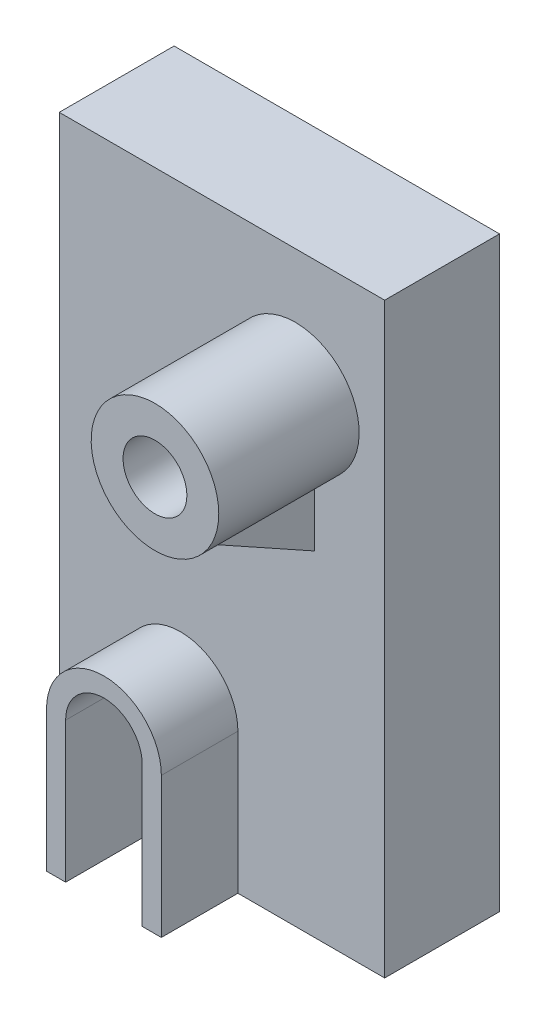
from build123d import *

# Parameters (mm, degrees)
EXTRUDE_2_DEPTH     = 18
EXTRUDE_3_DEPTH     = 30
SKETCH_1_8_R        = 5
EXTRUDE_4_DEPTH     = 40
EXTRUDE_5_DEPTH     = 36
CUT_EXTRUDE_1_DEPTH = 109


with BuildPart() as part:
    # Эскиз1 → Бобышка-Вытянуть2 (new body)
    with BuildSketch(Plane.XY):
        with BuildLine():
            Line((0, 92), (0, 0))
            Line((0, 0), (10, 0))
            Line((10, 0), (10, 22))
            ThreePointArc((10, 22), (19, 31), (28, 22))
            Line((28, 22), (28, 0))
            Line((28, 0), (51, 0))
            Line((51, 0), (51, 92))
            Line((51, 92), (0, 92))
        make_face()
        with BuildLine():
            Line((40, 52.460607986), (34, 52.460607986))
            Line((34, 52.460607986), (34, 62.460607986))
            ThreePointArc((34, 62.460607986), (31.083920217, 80.062257748), (47, 72))
            ThreePointArc((47, 72), (45.062257748, 66.083920217), (40, 62.460607986))
            Line((40, 62.460607986), (40, 52.460607986))
        make_face(mode=Mode.SUBTRACT)
    extrude(amount=EXTRUDE_2_DEPTH)

    # Эскиз1<6> → Бобышка-Вытянуть3 (add)
    with BuildSketch(Plane.XY):
        with BuildLine():
            Line((10, 22), (10, 0))
            Line((10, 0), (13, 0))
            Line((13, 0), (13, 22))
            ThreePointArc((13, 22), (19, 28), (25, 22))
            Line((25, 22), (25, 0))
            Line((25, 0), (28, 0))
            Line((28, 0), (28, 22))
            ThreePointArc((28, 22), (19, 31), (10, 22))
        make_face()
    extrude(amount=EXTRUDE_3_DEPTH)

    # Эскиз1<8> → Бобышка-Вытянуть4 (add)
    with BuildSketch(Plane.XY):
        with BuildLine():
            ThreePointArc((47, 72), (31.083920217, 80.062257748), (34, 62.460607986))
            ThreePointArc((34, 62.460607986), (37, 62), (40, 62.460607986))
            ThreePointArc((40, 62.460607986), (45.062257748, 66.083920217), (47, 72))
        make_face()
        with Locations((37, 72)):
            Circle(SKETCH_1_8_R, mode=Mode.SUBTRACT)
    extrude(amount=EXTRUDE_4_DEPTH)

    # Эскиз1<9> → Бобышка-Вытянуть5 (add)
    with BuildSketch(Plane.XY):
        with BuildLine():
            Line((34, 62.460607986), (34, 52.460607986))
            Line((34, 52.460607986), (40, 52.460607986))
            Line((40, 52.460607986), (40, 62.460607986))
            ThreePointArc((40, 62.460607986), (37, 62), (34, 62.460607986))
        make_face()
    extrude(amount=EXTRUDE_5_DEPTH)

    # Эскиз3 → Вырез-Вытянуть1 (cut, through all)
    with BuildSketch(Plane(origin=(40, 0, 0), x_dir=(0, 0, -1), z_dir=(1, 0, 0))):
        Polygon((-36, 62.460607986), (-18, 52.460607986), (-36, 52.460607986), align=None)
    extrude(amount=-CUT_EXTRUDE_1_DEPTH, mode=Mode.SUBTRACT)


solid = part.part
